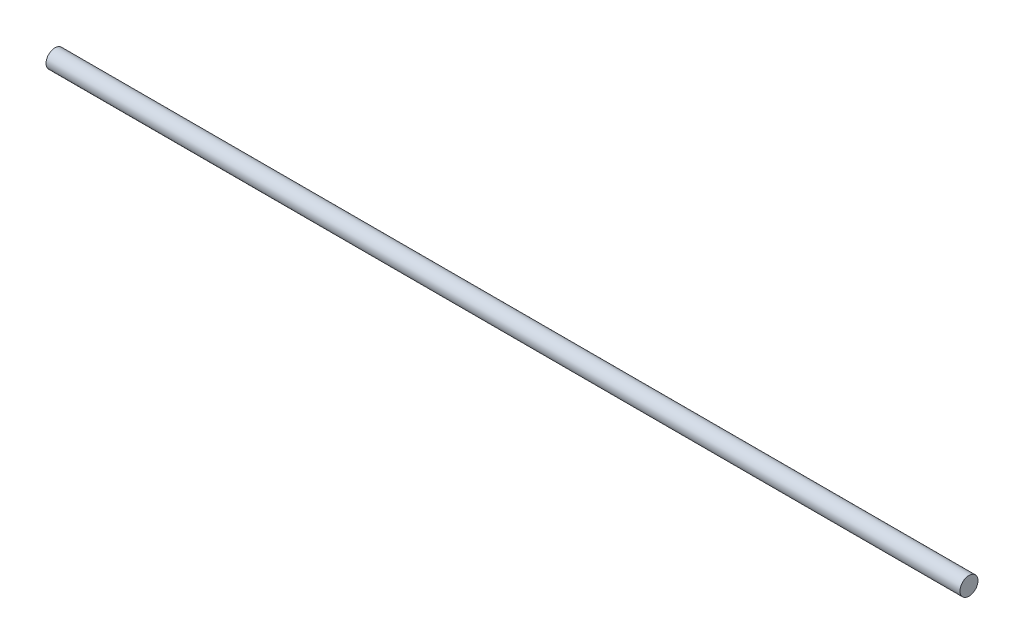
from build123d import *

# Parameters (mm, degrees)
SKETCH1_R           = 4
BOSS_EXTRUDE1_DEPTH = 202.5


with BuildPart() as part:
    # Sketch1 → Boss-Extrude1 (new, symmetric)
    with BuildSketch(Plane(origin=(0, 0, 0), x_dir=(0, 0, -1), z_dir=(1, 0, 0))):
        Circle(SKETCH1_R)
    extrude(amount=BOSS_EXTRUDE1_DEPTH, both=True)


solid = part.part
